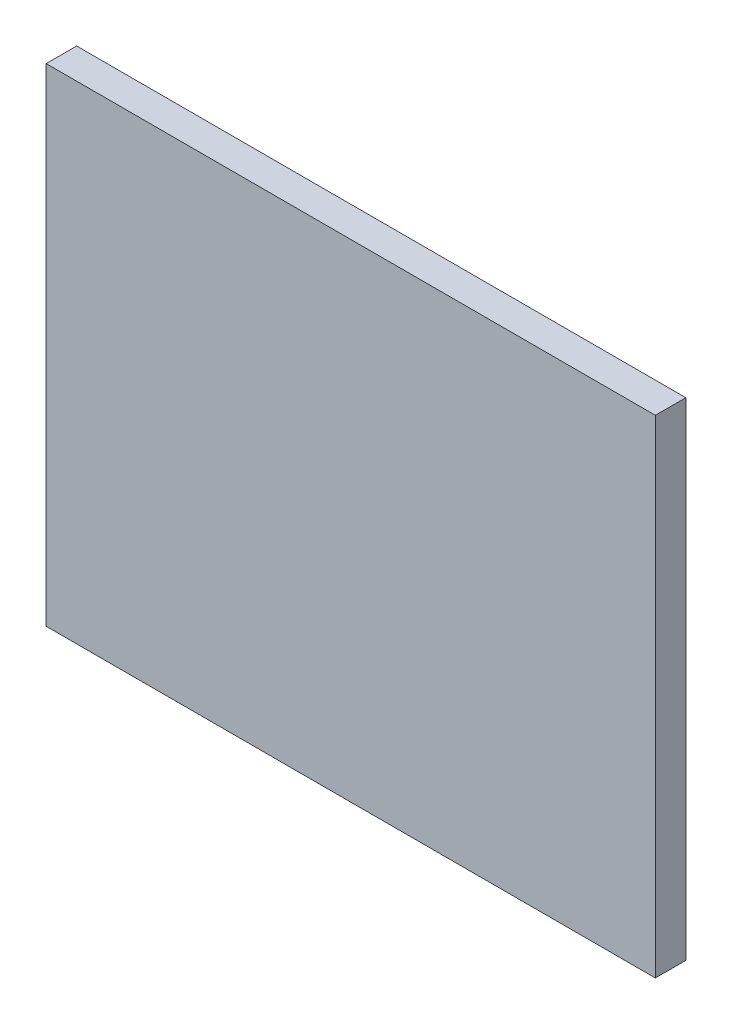
from build123d import *

# Parameters (mm, degrees)
SKETCH1_W           = 100
SKETCH1_H           = 80
BOSS_EXTRUDE1_DEPTH = 5


with BuildPart() as part:
    # Sketch1 → Boss-Extrude1 (new body)
    with BuildSketch(Plane.XY):
        with Locations((-2.764227642, -7.235772358)):
            Rectangle(SKETCH1_W, SKETCH1_H)
    extrude(amount=BOSS_EXTRUDE1_DEPTH)


solid = part.part
